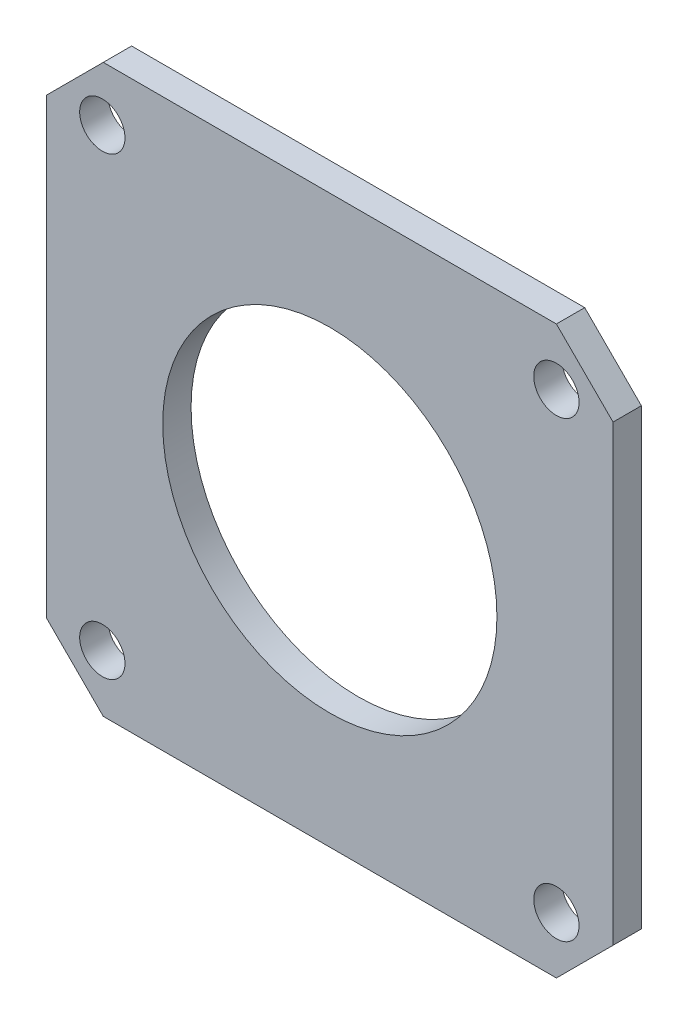
from build123d import *

# Parameters (mm, degrees)
SKETCH3_R               = 4
BOSS_EXTRUDE2_DEPTH     = 5
CUT_EXTRUDE1_DEPTH      = 4
CUT_EXTRUDE1_DEPTH_BACK = 24


with BuildPart() as part:
    # Sketch3 → Boss-Extrude2 (new body)
    with BuildSketch(Plane.XY):
        Polygon((10, 0), (90, 0), (100, 10), (100, 90), (90, 100), (10, 100), (0, 90), (0, 10), align=None)
        with Locations((90, 90)):
            Circle(SKETCH3_R, mode=Mode.SUBTRACT)
        with Locations((9.832174005, 90.33565199)):
            Circle(SKETCH3_R, mode=Mode.SUBTRACT)
        with Locations((9.832174005, 10)):
            Circle(SKETCH3_R, mode=Mode.SUBTRACT)
        with Locations((90, 10)):
            Circle(SKETCH3_R, mode=Mode.SUBTRACT)
    extrude(amount=-BOSS_EXTRUDE2_DEPTH)

    # Sketch5 → Cut-Extrude1 (cut, two sides: drawn at the far end of the back side and taken through both)
    with BuildSketch(Plane.XY.offset(-CUT_EXTRUDE1_DEPTH_BACK)):
        with BuildLine():
            ThreePointArc((79.5, 50), (70.859650045, 70.859650045), (50, 79.5))
            Line((50, 79.5), (50, 50))
            Line((50, 50), (79.5, 50))
        make_face()
        with BuildLine():
            Line((50, 50), (50, 79.5))
            ThreePointArc((50, 79.5), (29.140349955, 70.859650045), (20.5, 50))
            Line((20.5, 50), (50, 50))
        make_face()
        with BuildLine():
            Line((79.5, 50), (50, 50))
            Line((50, 50), (50, 20.5))
            ThreePointArc((50, 20.5), (70.859650045, 29.140349955), (79.5, 50))
        make_face()
        with BuildLine():
            Line((50, 20.5), (50, 50))
            Line((50, 50), (20.5, 50))
            ThreePointArc((20.5, 50), (29.140349955, 29.140349955), (50, 20.5))
        make_face()
    extrude(amount=CUT_EXTRUDE1_DEPTH + CUT_EXTRUDE1_DEPTH_BACK, mode=Mode.SUBTRACT)


solid = part.part
